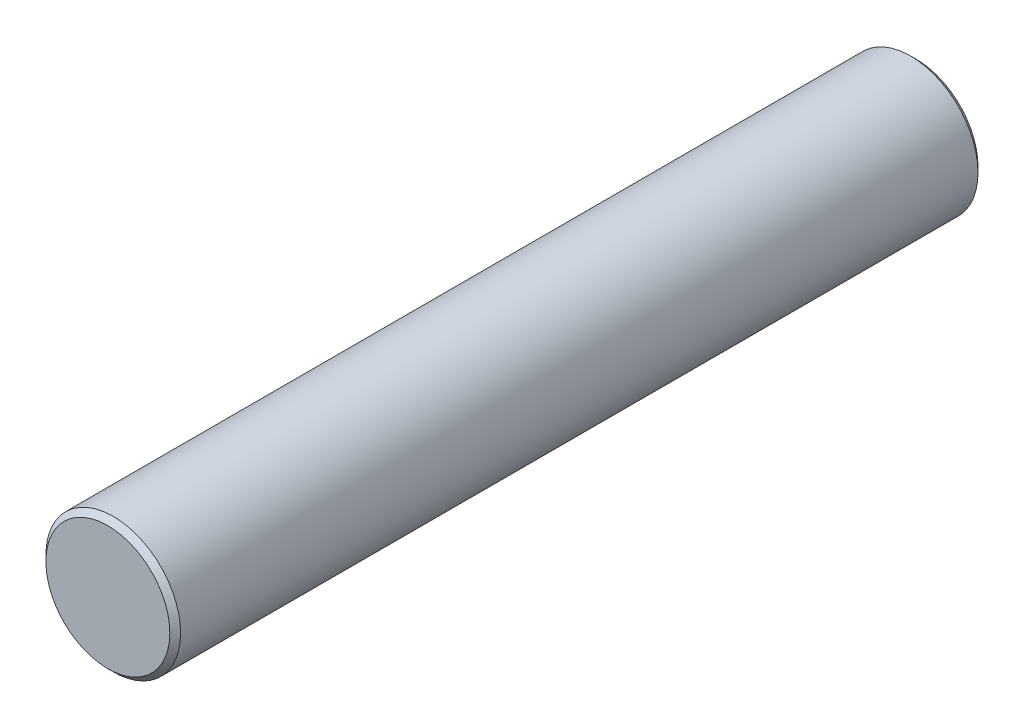
from build123d import *

# Parameters (mm, degrees)
SKETCH1_R           = 2.5
BOSS_EXTRUDE1_DEPTH = 30
CHAMFER1_SIZE       = 0.2


with BuildPart() as part:
    # Sketch1 → Boss-Extrude1 (new body)
    with BuildSketch(Plane.XY):
        Circle(SKETCH1_R)
    extrude(amount=-BOSS_EXTRUDE1_DEPTH)

    # Chamfer1
    chamfer1_edges = [part.edges().sort_by_distance(p)[0] for p in [
        (-2.5, 0, 0),
        (-2.5, 0, -30),
    ]]
    chamfer(chamfer1_edges, length=CHAMFER1_SIZE)


solid = part.part
